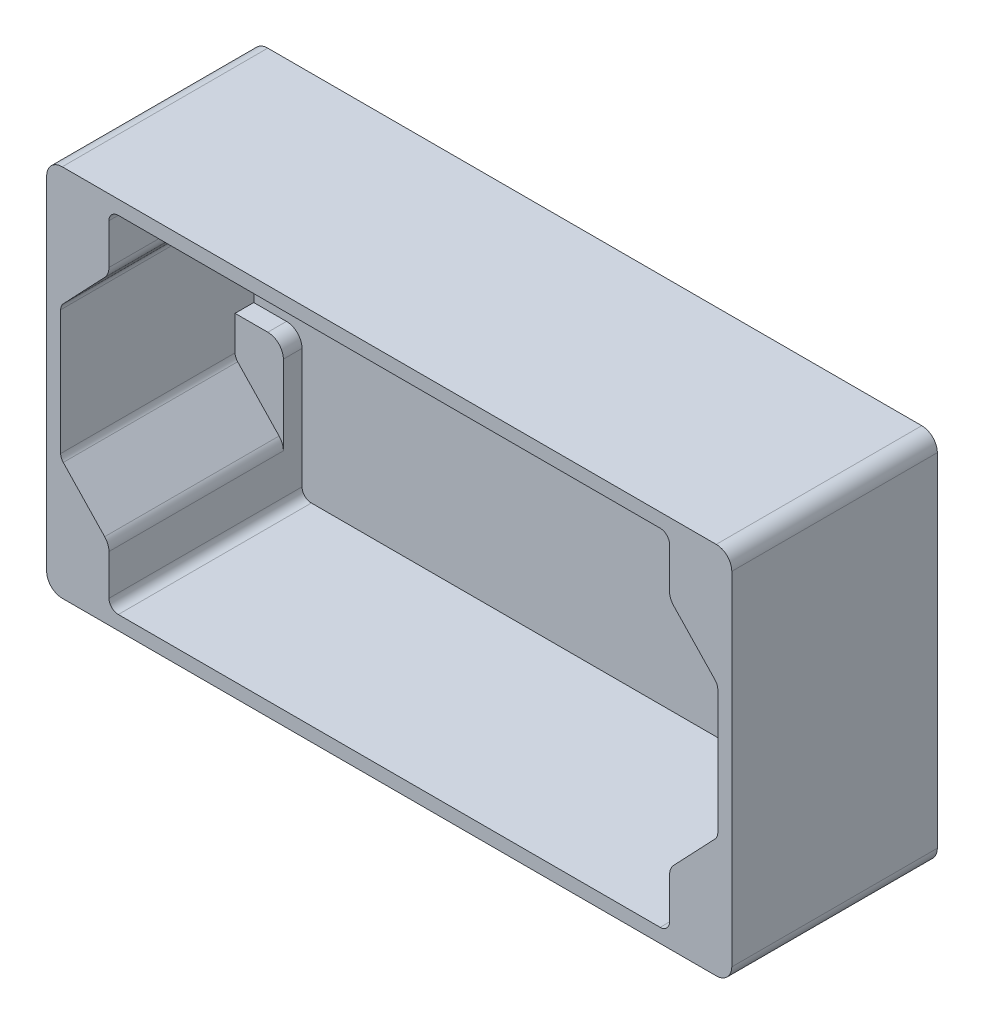
from build123d import *

# Parameters (mm, degrees)
SKETCH1_W           = 220
SKETCH1_H           = 120
BOSS_EXTRUDE1_DEPTH = 33
CUT_EXTRUDE1_DEPTH  = 56
CUT_EXTRUDE2_DEPTH  = 6
FILLET1_R           = 5


with BuildPart() as part:
    # Sketch1 → Boss-Extrude1 (new, symmetric)
    with BuildSketch(Plane.XY):
        Rectangle(SKETCH1_W, SKETCH1_H)
    extrude(amount=BOSS_EXTRUDE1_DEPTH, both=True)

    # Sketch2 → Cut-Extrude1 (cut)
    with BuildSketch(Plane.XY.offset(33)):
        with BuildLine():
            Line((-87, 55.5), (87, 55.5))
            ThreePointArc((87, 55.5), (89.121320344, 54.621320344), (90, 52.5))
            Line((90, 52.5), (90, 39.49693341))
            ThreePointArc((90, 39.49693341), (90.356635174, 37.642435339), (91.375665238, 36.052488965))
            Line((91.375665238, 36.052488965), (104.674600857, 22.059000191))
            ThreePointArc((104.674600857, 22.059000191), (105.286018895, 21.105032366), (105.5, 19.992333524))
            Line((105.5, 19.992333524), (105.5, -19.992333524))
            ThreePointArc((105.5, -19.992333524), (105.286018895, -21.105032366), (104.674600857, -22.059000191))
            Line((104.674600857, -22.059000191), (91.375665238, -36.052488965))
            ThreePointArc((91.375665238, -36.052488965), (90.356635174, -37.642435339), (90, -39.49693341))
            Line((90, -39.49693341), (90, -52.5))
            ThreePointArc((90, -52.5), (89.121320344, -54.621320344), (87, -55.5))
            Line((87, -55.5), (-87, -55.5))
            ThreePointArc((-87, -55.5), (-89.121320344, -54.621320344), (-90, -52.5))
            Line((-90, -52.5), (-90, -39.49693341))
            ThreePointArc((-90, -39.49693341), (-90.356635174, -37.642435339), (-91.375665238, -36.052488965))
            Line((-91.375665238, -36.052488965), (-104.674600857, -22.059000191))
            ThreePointArc((-104.674600857, -22.059000191), (-105.286018895, -21.105032366), (-105.5, -19.992333524))
            Line((-105.5, -19.992333524), (-105.5, 19.992333524))
            ThreePointArc((-105.5, 19.992333524), (-105.286018895, 21.105032366), (-104.674600857, 22.059000191))
            Line((-104.674600857, 22.059000191), (-91.375665238, 36.052488965))
            ThreePointArc((-91.375665238, 36.052488965), (-90.356635174, 37.642435339), (-90, 39.49693341))
            Line((-90, 39.49693341), (-90, 52.5))
            ThreePointArc((-90, 52.5), (-89.121320344, 54.621320344), (-87, 55.5))
        make_face()
    extrude(amount=-CUT_EXTRUDE1_DEPTH, mode=Mode.SUBTRACT)

    # Sketch3 → Cut-Extrude2 (cut)
    with BuildSketch(Plane.XY.offset(-23)):
        with BuildLine():
            Line((-90, 52.5), (-90, 39.49693341))
            Line((-90, 39.49693341), (-90, 14))
            ThreePointArc((-90, 14), (-91.464466094, 10.464466094), (-95, 9))
            Line((-95, 9), (-105.5, 9))
            Line((-105.5, 9), (-105.5, -9))
            Line((-105.5, -9), (-95, -9))
            ThreePointArc((-95, -9), (-91.464466094, -10.464466094), (-90, -14))
            Line((-90, -14), (-90, -39.49693341))
            Line((-90, -39.49693341), (-90, -52.5))
            ThreePointArc((-90, -52.5), (-89.121320344, -54.621320344), (-87, -55.5))
            Line((-87, -55.5), (87, -55.5))
            ThreePointArc((87, -55.5), (89.121320344, -54.621320344), (90, -52.5))
            Line((90, -52.5), (90, -39.49693341))
            Line((90, -39.49693341), (90, -14))
            ThreePointArc((90, -14), (91.464466094, -10.464466094), (95, -9))
            Line((95, -9), (105.5, -9))
            Line((105.5, -9), (105.5, 9))
            Line((105.5, 9), (95, 9))
            ThreePointArc((95, 9), (91.464466094, 10.464466094), (90, 14))
            Line((90, 14), (90, 39.49693341))
            Line((90, 39.49693341), (90, 52.5))
            ThreePointArc((90, 52.5), (89.121320344, 54.621320344), (87, 55.5))
            Line((87, 55.5), (-87, 55.5))
            ThreePointArc((-87, 55.5), (-89.121320344, 54.621320344), (-90, 52.5))
        make_face()
    extrude(amount=-CUT_EXTRUDE2_DEPTH, mode=Mode.SUBTRACT)

    # Fillet1
    fillet1_edges = [part.edges().sort_by_distance(p)[0] for p in [
        (-110, 60, 0),
        (110, 60, 0),
        (110, -60, 0),
        (-110, -60, 0),
    ]]
    fillet(fillet1_edges, radius=FILLET1_R)


solid = part.part
